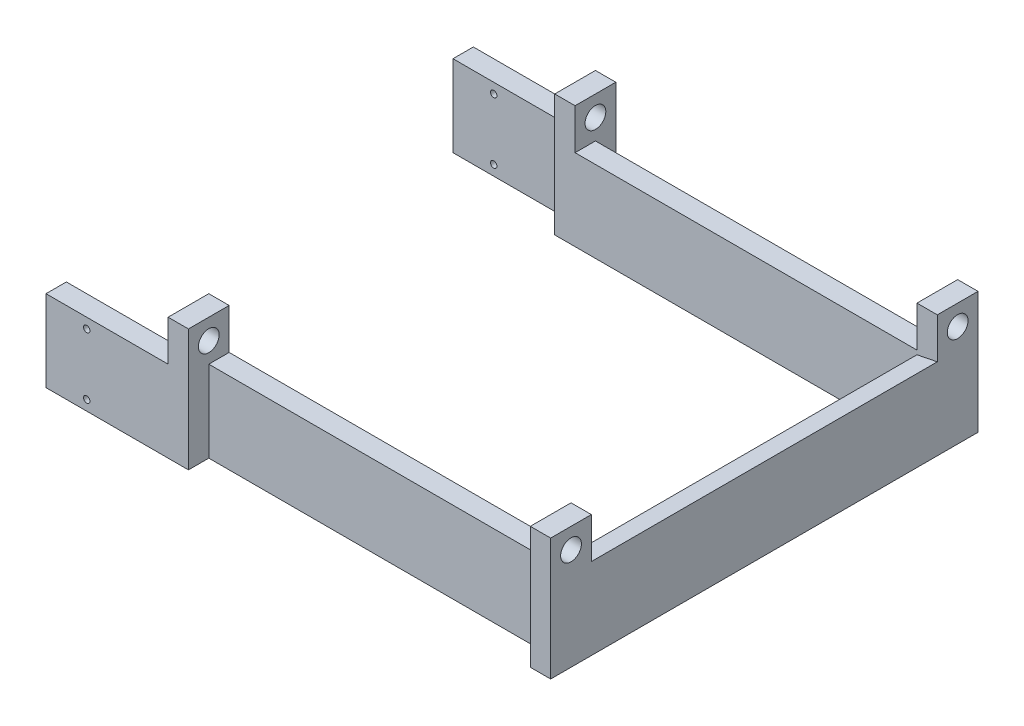
from build123d import *

# Parameters (mm, degrees)
BOSS_EXTRUDE1_DEPTH     = 25.4
CUT_EXTRUDE1_START      = -6.35
CUT_EXTRUDE1_DEPTH      = 107.95
SKETCH3_W               = 44.45
SKETCH3_H               = 25.4
BOSS_EXTRUDE2_DEPTH     = 6.35
BOSS_EXTRUDE3_START     = -120.65
SKETCH3_2_W             = 44.45
SKETCH3_2_H             = 25.4
BOSS_EXTRUDE3_DEPTH     = 6.35
BOSS_EXTRUDE4_START     = -25.4
SKETCH8_W               = 6.35
SKETCH8_H               = 12.7
BOSS_EXTRUDE4_DEPTH     = 38.1
CUT_EXTRUDE2_DEPTH      = 206.865393886
CUT_EXTRUDE2_DEPTH_BACK = 206.865393886
SKETCH9_R               = 3.2385
SKETCH10_R              = 1.000000032
CUT_EXTRUDE3_DEPTH      = 183.990209847


with BuildPart() as part:
    # Sketch1 → Boss-Extrude1 (new body)
    with BuildSketch(Plane(origin=(0, 0, 0), x_dir=(1, 0, 0), z_dir=(0, 1, 0))):
        Polygon((3.175, 114.3), (0, 114.3), (0, 120.65), (119.38, 120.65), (119.38, 0), (0, 0), (0, 6.35), (3.175, 6.35), (113.03, 6.35), (113.03, 114.3), align=None)
    extrude(amount=BOSS_EXTRUDE1_DEPTH)

    # Sketch2 → Cut-Extrude1 (cut)
    with BuildSketch(Plane.XY.offset(CUT_EXTRUDE1_START)):
        Polygon((119.38, 25.4), (113.03, 24.13), (113.03, 25.4), align=None)
    extrude(amount=-CUT_EXTRUDE1_DEPTH, mode=Mode.SUBTRACT)

    # Sketch3 → Boss-Extrude2 (add)
    with BuildSketch(Plane.XY):
        with Locations((-15.875, 12.7)):
            Rectangle(SKETCH3_W, SKETCH3_H)
    extrude(amount=BOSS_EXTRUDE2_DEPTH)

    # Sketch3<2> → Boss-Extrude3 (add)
    with BuildSketch(Plane.XY.offset(BOSS_EXTRUDE3_START)):
        with Locations((-15.875, 12.7)):
            Rectangle(SKETCH3_2_W, SKETCH3_2_H)
    extrude(amount=-BOSS_EXTRUDE3_DEPTH)

    # Sketch8 → Boss-Extrude4 (add)
    with BuildSketch(Plane(origin=(0, 25.4, 0), x_dir=(1, 0, 0), z_dir=(0, 1, 0)).offset(BOSS_EXTRUDE4_START)):
        with Locations((116.205, 0)):
            Rectangle(SKETCH8_W, SKETCH8_H)
        with Locations((3.175, 0)):
            Rectangle(SKETCH8_W, SKETCH8_H)
        with Locations((3.175, 120.65)):
            Rectangle(SKETCH8_W, SKETCH8_H)
        with Locations((116.205, 120.65)):
            Rectangle(SKETCH8_W, SKETCH8_H)
    extrude(amount=BOSS_EXTRUDE4_DEPTH)

    # Sketch9 → Cut-Extrude2 (cut, two sides: drawn at the far end of the back side and taken through both)
    with BuildSketch(Plane(origin=(119.38, 0, 0), x_dir=(0, 0, -1), z_dir=(1, 0, 0)).offset(-CUT_EXTRUDE2_DEPTH_BACK)):
        with Locations((0, 31.75)):
            Circle(SKETCH9_R)
        with Locations((120.65, 31.75)):
            Circle(SKETCH9_R)
    extrude(amount=CUT_EXTRUDE2_DEPTH + CUT_EXTRUDE2_DEPTH_BACK, mode=Mode.SUBTRACT)

    # Sketch10 → Cut-Extrude3 (cut, through all)
    with BuildSketch(Plane.XY.offset(6.35)):
        with Locations((-25.4, 22.225)):
            Circle(SKETCH10_R)
        with Locations((-25.4, 3.175)):
            Circle(SKETCH10_R)
    extrude(amount=-CUT_EXTRUDE3_DEPTH, mode=Mode.SUBTRACT)


solid = part.part
